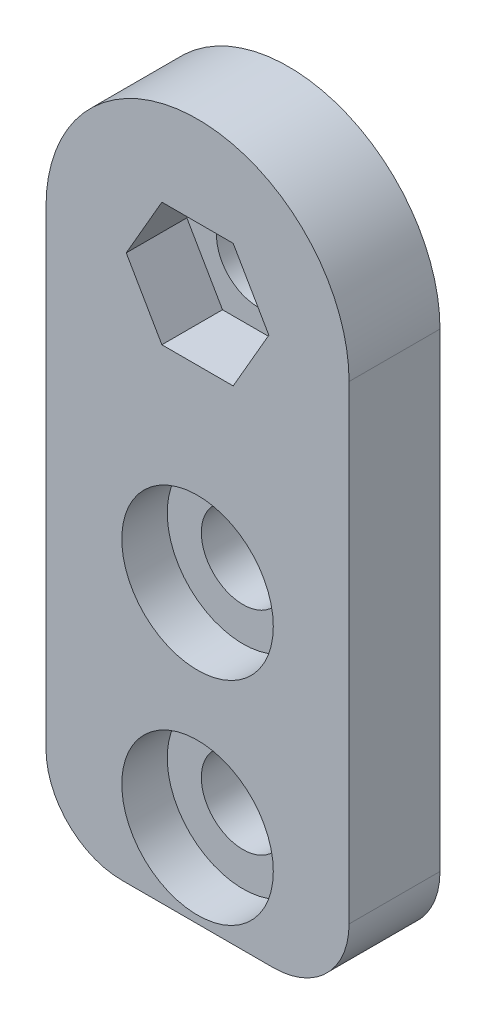
from build123d import *

# Parameters (mm, degrees)
SKETCH_2_R          = 2.75
EXTRUDE_1_DEPTH     = 6
SKETCH_3_R          = 5
CUT_EXTRUDE_1_DEPTH = 3
FILLET_1_R          = 5
CUT_EXTRUDE_2_DEPTH = 4


with BuildPart() as part:
    # Эскиз2 → Бобышка-Вытянуть1 (new body)
    with BuildSketch(Plane.XY):
        with BuildLine():
            Line((10, 18), (10, -18))
            Line((10, -18), (-10, -18))
            Line((-10, -18), (-10, 18))
            ThreePointArc((-10, 18), (0, 28), (10, 18))
        make_face()
        with Locations((0, 1.5)):
            Circle(SKETCH_2_R, mode=Mode.SUBTRACT)
        with Locations((0, -12.5)):
            Circle(SKETCH_2_R, mode=Mode.SUBTRACT)
        with Locations((0, 18)):
            Circle(SKETCH_2_R, mode=Mode.SUBTRACT)
    extrude(amount=EXTRUDE_1_DEPTH)

    # Эскиз3 → Вырез-Вытянуть1 (cut)
    with BuildSketch(Plane.XY.offset(6)):
        with Locations((0, 1.5)):
            Circle(SKETCH_3_R)
        with Locations((0, -12.5)):
            Circle(SKETCH_3_R)
    extrude(amount=-CUT_EXTRUDE_1_DEPTH, mode=Mode.SUBTRACT)

    # Скругление1
    fillet_1_edges = [part.edges().sort_by_distance(p)[0] for p in [
        (10, -18, 3),
        (-10, -18, 3),
    ]]
    fillet(fillet_1_edges, radius=FILLET_1_R)

    # Эскиз4 → Вырез-Вытянуть2 (cut)
    with BuildSketch(Plane.XY.offset(6)):
        Polygon((2.352702347, 13.925), (4.705404694, 18), (2.352702347, 22.075), (-2.352702347, 22.075), (-4.705404694, 18), (-2.352702347, 13.925), align=None)
    extrude(amount=-CUT_EXTRUDE_2_DEPTH, mode=Mode.SUBTRACT)


solid = part.part
